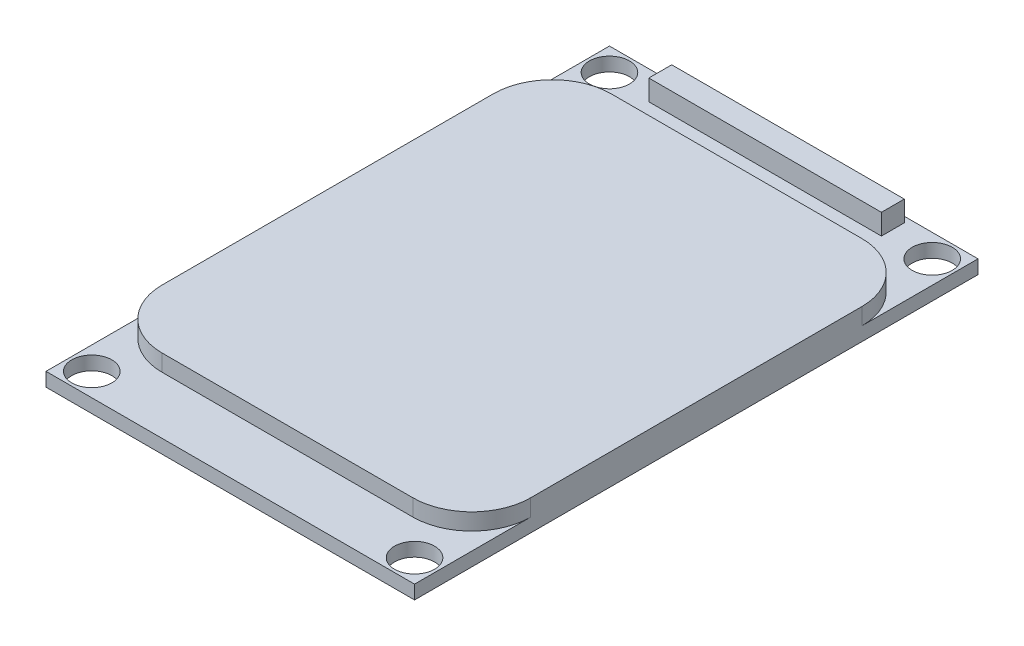
from build123d import *

# Parameters (mm, degrees)
SKETCH_1_W          = 32.2
SKETCH_1_H          = 49.23
EXTRUDE_1_DEPTH     = 1.2
SKETCH_2_W          = 20.32
SKETCH_2_H          = 2
EXTRUDE_2_DEPTH     = 1.8
SKETCH_2_3_R        = 1.75
CUT_EXTRUDE_1_DEPTH = 1.8
EXTRUDE_3_DEPTH     = 1.46


with BuildPart() as part:
    # 草图1 → 凸台-拉伸1 (new body)
    with BuildSketch(Plane(origin=(0, 0, 0), x_dir=(1, 0, 0), z_dir=(0, 1, 0))):
        with Locations((0.963198928, -6.298805668)):
            Rectangle(SKETCH_1_W, SKETCH_1_H)
    extrude(amount=EXTRUDE_1_DEPTH)

    # 草图2 → 凸台-拉伸2 (add)
    with BuildSketch(Plane(origin=(0, 1.2, 0), x_dir=(1, 0, 0), z_dir=(0, 1, 0))):
        with Locations((0.963198928, 16.816194332)):
            Rectangle(SKETCH_2_W, SKETCH_2_H)
    extrude(amount=EXTRUDE_2_DEPTH)

    # 草图2<3> → 切除-拉伸1 (cut)
    with BuildSketch(Plane(origin=(0, 1.2, 0), x_dir=(1, 0, 0), z_dir=(0, 1, 0))):
        with Locations((-13.136801072, 16.316194332)):
            Circle(SKETCH_2_3_R)
        with Locations((15.063198928, 16.316194332)):
            Circle(SKETCH_2_3_R)
        with Locations((-13.136801072, -28.913805668)):
            Circle(SKETCH_2_3_R)
        with Locations((15.063198928, -28.913805668)):
            Circle(SKETCH_2_3_R)
    extrude(amount=-CUT_EXTRUDE_1_DEPTH, mode=Mode.SUBTRACT)

    # 草图3 → 凸台-拉伸3 (add)
    with BuildSketch(Plane(origin=(0, 1.2, 0), x_dir=(1, 0, 0), z_dir=(0, 1, 0))):
        with BuildLine():
            Line((-9.986801072, 13.316194332), (11.913198928, 13.316194332))
            ThreePointArc((11.913198928, 13.316194332), (15.554798851, 11.807794255), (17.063198928, 8.166194332))
            Line((17.063198928, 8.166194332), (17.063198928, -20.763805668))
            ThreePointArc((17.063198928, -20.763805668), (15.554798851, -24.405405591), (11.913198928, -25.913805668))
            Line((11.913198928, -25.913805668), (-9.986801072, -25.913805668))
            ThreePointArc((-9.986801072, -25.913805668), (-13.628400995, -24.405405591), (-15.136801072, -20.763805668))
            Line((-15.136801072, -20.763805668), (-15.136801072, 8.166194332))
            ThreePointArc((-15.136801072, 8.166194332), (-13.628400995, 11.807794255), (-9.986801072, 13.316194332))
        make_face()
    extrude(amount=EXTRUDE_3_DEPTH)


solid = part.part
